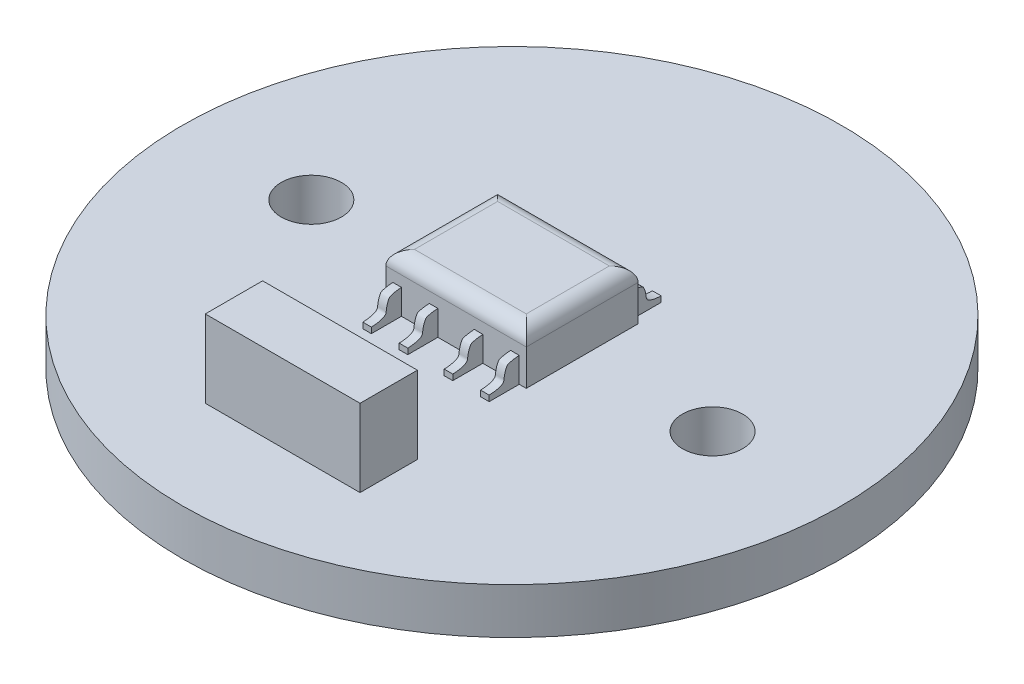
from build123d import *

# Parameters (mm, degrees)
SKETCH1_R               = 11.5
SKETCH1_R_2             = 1.05
BOSS_EXTRUDE1_DEPTH     = 1.6
SKETCH2_W               = 4.9
SKETCH2_H               = 3.9
BOSS_EXTRUDE2_DEPTH     = 1.75
SKETCH3_W               = 0.3
SKETCH3_H               = 1.05
BOSS_EXTRUDE3_DEPTH     = 0.875
MIRROR2_COPY_1_SKETCH_W = 0.3
MIRROR2_COPY_1_SKETCH_H = 1.05
MIRROR2_COPY_1_DEPTH    = 0.875
FILLET1_R               = 0.5
CUT_EXTRUDE1_DEPTH      = 19.201635229
SKETCH5_W               = 5.4
SKETCH5_H               = 2
BOSS_EXTRUDE4_DEPTH     = 2.7


with BuildPart() as part:
    # Sketch1 → Boss-Extrude1 (new body)
    with BuildSketch(Plane(origin=(0, 0, 0), x_dir=(1, 0, 0), z_dir=(0, 1, 0))):
        with Locations(Location((0, 0, 0), (0, 0, 270))):
            Circle(SKETCH1_R)
        with Locations(Location((-7, 0, 0), (0, 0, 270))):
            Circle(SKETCH1_R_2, mode=Mode.SUBTRACT)
        with Locations(Location((7, 0, 0), (0, 0, 270))):
            Circle(SKETCH1_R_2, mode=Mode.SUBTRACT)
    extrude(amount=BOSS_EXTRUDE1_DEPTH)

    # Sketch2 → Boss-Extrude2 (add)
    with BuildSketch(Plane(origin=(0, 1.6, 0), x_dir=(1, 0, 0), z_dir=(0, 1, 0))):
        Rectangle(SKETCH2_W, SKETCH2_H)
    extrude(amount=BOSS_EXTRUDE2_DEPTH)

    # Sketch3 → Boss-Extrude3 (add)
    with BuildSketch(Plane(origin=(0, 1.6, 0), x_dir=(1, 0, 0), z_dir=(0, 1, 0))):
        with Locations((-2.055, -2.475)):
            Rectangle(SKETCH3_W, SKETCH3_H)
        with Locations((-0.785, -2.475)):
            Rectangle(SKETCH3_W, SKETCH3_H)
    boss_extrude3 = extrude(amount=BOSS_EXTRUDE3_DEPTH)

    # Mirror1: Boss-Extrude3 across plane
    add(boss_extrude3.mirror(Plane(origin=(0, 0, 0), x_dir=(0, 0, 1), z_dir=(1, 0, 0))))

    # Mirror2: Boss-Extrude3 across plane
    add(boss_extrude3.mirror(Plane.XY))

    # Mirror2 copy 1 sketch → Mirror2 copy 1 (add)
    with BuildSketch(Plane(origin=(0, 1.6, 0), x_dir=(-1, 0, 0), z_dir=(0, 1, 0))):
        with Locations((-2.055, -2.475)):
            Rectangle(MIRROR2_COPY_1_SKETCH_W, MIRROR2_COPY_1_SKETCH_H)
        with Locations((-0.785, -2.475)):
            Rectangle(MIRROR2_COPY_1_SKETCH_W, MIRROR2_COPY_1_SKETCH_H)
    extrude(amount=MIRROR2_COPY_1_DEPTH)

    # Fillet1
    fillet1_edges = [part.edges().sort_by_distance(p)[0] for p in [
        (2.45, 3.35, 0),
        (0, 3.35, -1.95),
        (-2.45, 3.35, 0),
        (0, 3.35, 1.95),
    ]]
    fillet(fillet1_edges, radius=FILLET1_R)

    # Sketch4 → Cut-Extrude1 (cut, symmetric)
    with BuildSketch(Plane(origin=(2.205, 0, 0), x_dir=(0, 0, -1), z_dir=(1, 0, 0))):
        with BuildLine():
            Line((1.95, 2.475), (3, 2.475))
            Line((3, 2.475), (3, 1.8))
            add(Edge.make_bspline(
                [(1.95, 2.475), (2.11282764, 2.469119828), (2.355374015, 2.418848487), (2.406128477, 2.315792307), (2.472012078, 2.177966716), (2.490807891, 1.870806769), (2.800865545, 1.800605138), (3, 1.8)],
                knots=[0, 0, 0, 0, 0.320657498, 0.400502937, 0.754237561, 0.81860895, 1, 1, 1, 1], degree=3))
        make_face()
    cut_extrude1 = extrude(amount=CUT_EXTRUDE1_DEPTH, both=True, mode=Mode.SUBTRACT)

    # Mirror3: Cut-Extrude1 across plane
    add(cut_extrude1.mirror(Plane.XY), mode=Mode.SUBTRACT)

    # Sketch5 → Boss-Extrude4 (add)
    with BuildSketch(Plane(origin=(0, 1.6, 0), x_dir=(1, 0, 0), z_dir=(0, 1, 0))):
        with Locations((0, -7)):
            Rectangle(SKETCH5_W, SKETCH5_H)
    extrude(amount=BOSS_EXTRUDE4_DEPTH)


solid = part.part
